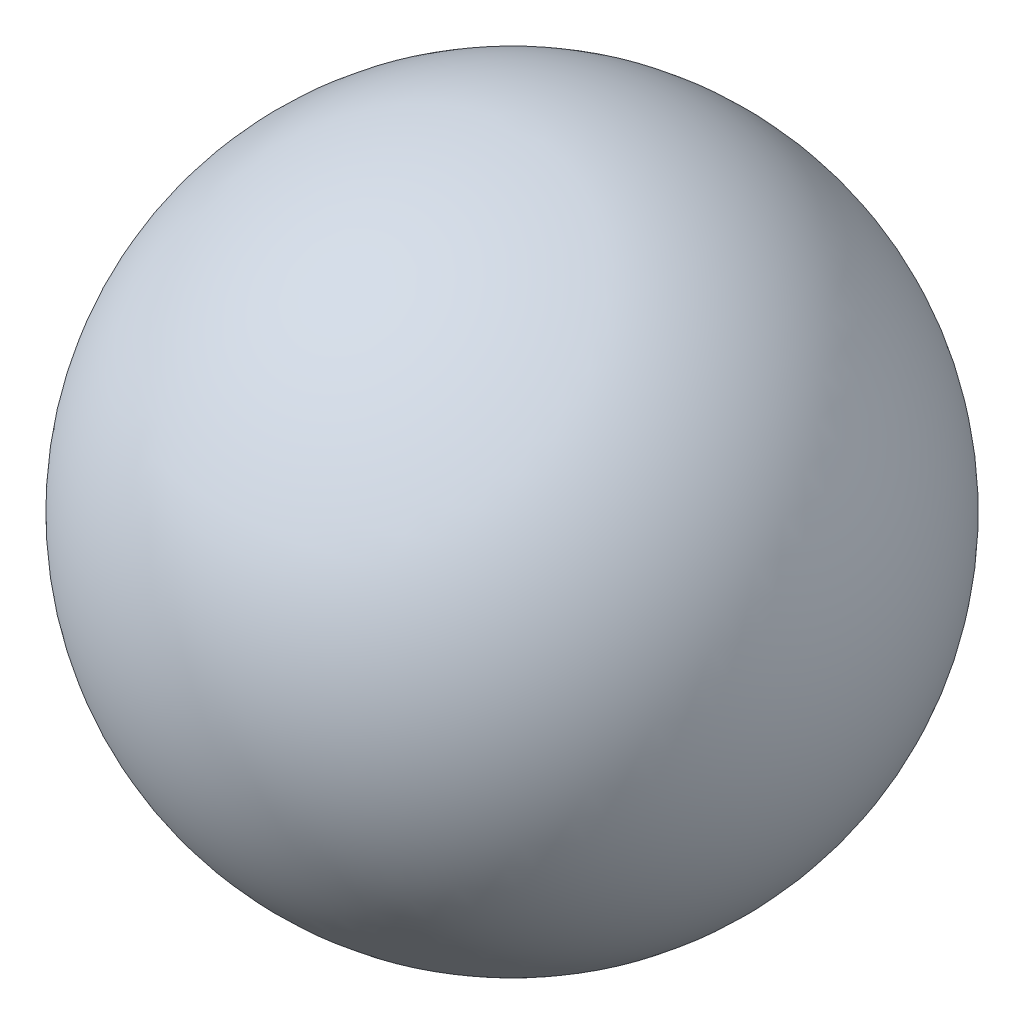
from build123d import *


with BuildPart() as part:
    # Sketch1 → Revolve1 (revolve)
    with BuildSketch(Plane.XY):
        with BuildLine():
            Line((0, 6.8199), (0, -6.8199))
            ThreePointArc((0, -6.8199), (6.8199, 0), (0, 6.8199))
        make_face()
    revolve(axis=Axis((0, 6.8199, 0), (0, -1, 0)))


solid = part.part
